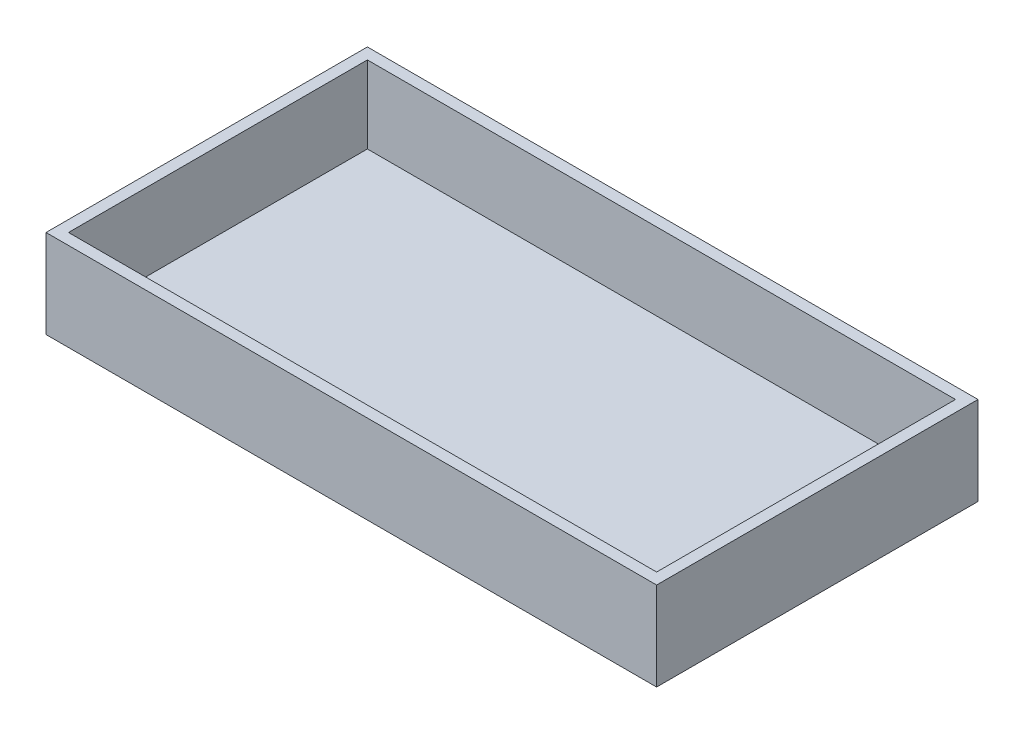
from build123d import *

# Parameters (mm, degrees)
SKETCH_1_W          = 380
SKETCH_1_H          = 200
EXTRUDE_1_DEPTH     = 55
SKETCH_2_W          = 366
SKETCH_2_H          = 186
CUT_EXTRUDE_1_DEPTH = 48


with BuildPart() as part:
    # 草图1 → 凸台-拉伸1 (new body)
    with BuildSketch(Plane(origin=(0, 0, 0), x_dir=(1, 0, 0), z_dir=(0, 1, 0))):
        Rectangle(SKETCH_1_W, SKETCH_1_H)
    extrude(amount=EXTRUDE_1_DEPTH)

    # 草图2 → 切除-拉伸1 (cut)
    with BuildSketch(Plane(origin=(0, 55, 0), x_dir=(1, 0, 0), z_dir=(0, 1, 0))):
        Rectangle(SKETCH_2_W, SKETCH_2_H)
    extrude(amount=-CUT_EXTRUDE_1_DEPTH, mode=Mode.SUBTRACT)


solid = part.part
